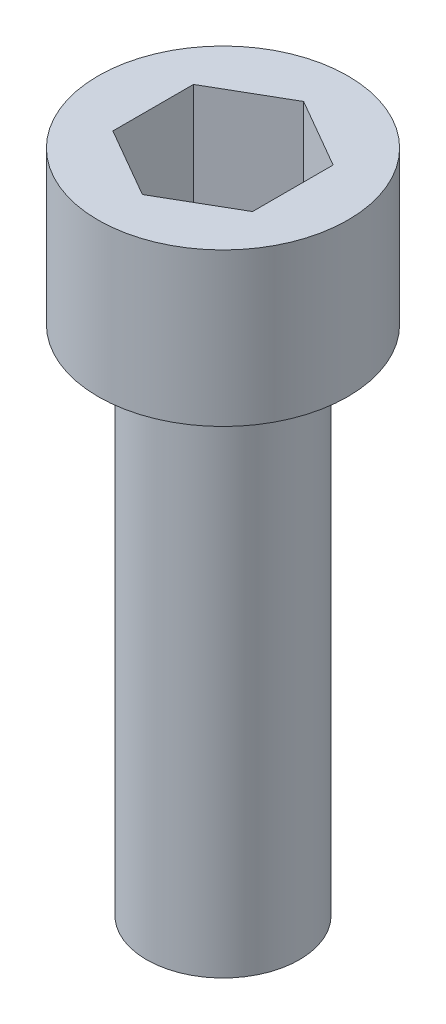
from build123d import *

# Parameters (mm, degrees)
SKETCH1_R           = 2.3241
BOSS_EXTRUDE1_DEPTH = 2.8448
CUT_EXTRUDE1_DEPTH  = 2
SKETCH4_R           = 1.4224
BOSS_EXTRUDE2_DEPTH = 9.525


with BuildPart() as part:
    # Sketch1 → Boss-Extrude1 (new body)
    with BuildSketch(Plane(origin=(0, 0, 0), x_dir=(1, 0, 0), z_dir=(0, 1, 0))):
        with Locations(Location((0, 0, 0), (0, 0, 270))):
            Circle(SKETCH1_R)
    extrude(amount=BOSS_EXTRUDE1_DEPTH)

    # Sketch3 → Cut-Extrude1 (cut)
    with BuildSketch(Plane(origin=(0, 2.8448, 0), x_dir=(1, 0, 0), z_dir=(0, 1, 0))):
        Polygon((-1.299038106, 0.75), (-1.299038106, -0.75), (0, -1.5), (1.299038106, -0.75), (1.299038106, 0.75), (0, 1.5), align=None)
    extrude(amount=-CUT_EXTRUDE1_DEPTH, mode=Mode.SUBTRACT)

    # Sketch4 → Boss-Extrude2 (add)
    with BuildSketch(Plane.XZ):
        with Locations(Location((0, 0, 0), (0, 0, 90))):
            Circle(SKETCH4_R)
    extrude(amount=BOSS_EXTRUDE2_DEPTH)


solid = part.part
